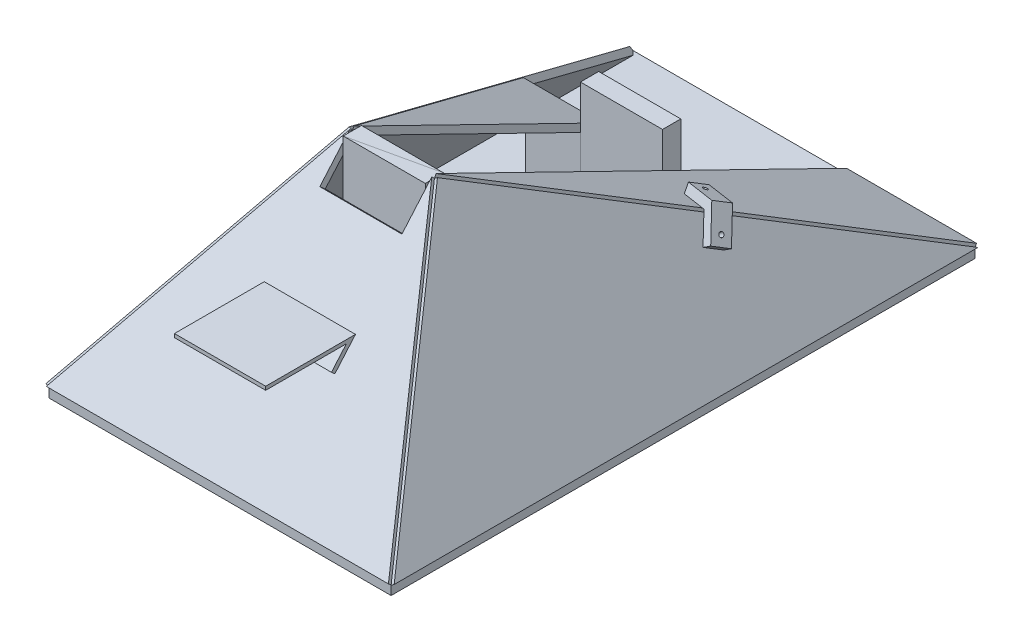
from build123d import *

# Parameters (mm, degrees)
BOSS_EXTRUDE1_DEPTH                  = 5
BOSS_EXTRUDE2_DEPTH                  = 5
SKETCH2_W                            = 114.3
SKETCH2_H                            = 25.4
BOSS_EXTRUDE3_DEPTH                  = 279.4
BOSS_EXTRUDE3_2_DEPTH                = 279.4
BOSS_EXTRUDE4_DEPTH                  = 25.4
SKETCH1_W                            = 476.25
SKETCH1_H                            = 812.8
BOSS_EXTRUDE5_DEPTH                  = 12.7
BOSS_EXTRUDE6_DEPTH                  = 25.4
MOVE_FACE1_BY                        = 6.35
MOVE_FACE1_2_BY                      = 6.35
BOSS_EXTRUDE7_DEPTH                  = 5
BOSS_EXTRUDE8_DEPTH                  = 5
BOSS_EXTRUDE9_DEPTH                  = 25.4
BOSS_EXTRUDE10_DEPTH                 = 63.5
CUT_EXTRUDE1_DEPTH                   = 3
SKETCH26_W                           = 3.175
SKETCH26_H                           = 631.796713068
F_1_4_0_25_DIAMETER_HOLE1_AT_2_COUNT = 2
F_1_4_0_25_DIAMETER_HOLE1_AT_2_PITCH = 63.5
BOSS_EXTRUDE11_DEPTH                 = 25.4
BOSS_EXTRUDE12_DEPTH                 = 25.4
MOVE_FACE2_BY                        = 6.35
MOVE_FACE3_BY                        = 50.8
BOSS_EXTRUDE13_START                 = -310
BOSS_EXTRUDE13_DEPTH                 = 25.4
SKETCH40_W                           = 3.175
SKETCH40_H                           = 386.099476677
SKETCH42_W                           = 3.175
SKETCH42_H                           = 424.327688964
SKETCH43_W                           = 114.3
SKETCH43_H                           = 25.4
BOSS_EXTRUDE15_DEPTH                 = 279.4
SKETCH44_W                           = 114.3
SKETCH44_H                           = 25.4
CUT_EXTRUDE2_DEPTH                   = 100
BOSS_EXTRUDE16_DEPTH                 = 10


with BuildPart() as part:
    # Sketch4 → Boss-Extrude1 (new, symmetric)
    with BuildSketch(Plane(origin=(167.746747931, 108.654143546, 0), x_dir=(0, 0, -1), z_dir=(0.8393141755459909, 0.5436466818877439, 0))):
        Polygon((-406.4, -129.455866125), (-165.1, 203.434972778), (406.4, -129.455866125), align=None)
    extrude(amount=BOSS_EXTRUDE1_DEPTH, both=True)


with BuildPart() as body_2:
    # Sketch5 → Boss-Extrude2 (new, symmetric)
    with BuildSketch(Plane(origin=(-167.746747931, 108.654143546, 0), x_dir=(0, 0, 1), z_dir=(-0.8393141755459907, 0.543646681887744, 0))):
        Polygon((165.1, 203.434972778), (-406.4, -129.455866125), (406.4, -129.455866125), align=None)
    extrude(amount=BOSS_EXTRUDE2_DEPTH, both=True)


with BuildPart() as body_3:
    # Sketch2 → Boss-Extrude3 (new body)
    with BuildSketch(Plane(origin=(0, 279.4, 0), x_dir=(1, 0, 0), z_dir=(0, 1, 0))):
        with Locations((0, -165.1)):
            Rectangle(SKETCH2_W, SKETCH2_H)
    extrude(amount=-BOSS_EXTRUDE3_DEPTH)

    # Sketch1 → Boss-Extrude5 (add)
    with BuildSketch(Plane(origin=(0, 0, 0), x_dir=(1, 0, 0), z_dir=(0, 1, 0))):
        Rectangle(SKETCH1_W, SKETCH1_H)
    extrude(amount=-BOSS_EXTRUDE5_DEPTH)


with BuildPart() as body_4:
    # Sketch2 → Boss-Extrude3 2 (new body)
    with BuildSketch(Plane(origin=(0, 279.4, 0), x_dir=(1, 0, 0), z_dir=(0, 1, 0))):
        with Locations((0, 165.1)):
            Rectangle(SKETCH2_W, SKETCH2_H)
    extrude(amount=-BOSS_EXTRUDE3_2_DEPTH)

    # Sketch44 → Cut-Extrude2 (cut)
    with BuildSketch(Plane(origin=(0, 279.4, 0), x_dir=(1, 0, 0), z_dir=(0, 1, 0))):
        with Locations((0, 165.1)):
            Rectangle(SKETCH44_W, SKETCH44_H)
    extrude(amount=-CUT_EXTRUDE2_DEPTH, mode=Mode.SUBTRACT)


with BuildPart() as body_5:
    # Sketch6 → Boss-Extrude4 (new body)
    with BuildSketch(Plane.XY.offset(177.8)):
        Polygon((57.15, 152.560744885), (57.15, 177.960744885), (116.897727273, 177.960744885), (133.35, 152.560744885), align=None)
    extrude(amount=-BOSS_EXTRUDE4_DEPTH)

    # Sketch9 → CBORE for 1_4 Binding Head Machine Screw (revolve, cut)
    with BuildSketch(Plane(origin=(133.35, 165.260744885, 165.1), x_dir=(0, 0, -1), z_dir=(0, 1, 0))):
        Polygon((0, 0), (0, 375.671570878), (3.3782, 375.671570878), (3.3782, 54.1910016), (7.14375, 54.1910016), (7.14375, 0), align=None)
    revolve(axis=Axis((139.7, 165.260744885, 165.1), (-1, 0, 0)), mode=Mode.SUBTRACT)


with BuildPart() as body_6:
    # Sketch10 → Boss-Extrude6 (new body)
    with BuildSketch(Plane.XY.offset(177.8)):
        Polygon((182.810937028, 0), (208.210937028, 0), (208.210937028, 36.985964912), (182.810937028, 76.2), align=None)
    extrude(amount=BOSS_EXTRUDE6_DEPTH)

    # Sketch12 → CBORE for 1_4 Binding Head Machine S 2 (revolve, cut)
    with BuildSketch(Plane(origin=(195.510937028, 76.2, 190.5), x_dir=(0, 0, 1), z_dir=(1, 0, 0))):
        Polygon((0, 0), (0, 88.9), (3.3782, 88.9), (3.3782, 64.191007), (7.14375, 64.191007), (7.14375, 0), align=None)
    revolve(axis=Axis((195.510937028, 82.55, 190.5), (0, -1, 0)), mode=Mode.SUBTRACT)


with BuildPart() as body_7:
    # Mirror2: mirrored copy
    add(body_6.part.mirror(Plane(origin=(0, 0, 0), x_dir=(0, 0, 1), z_dir=(1, 0, 0))))

    # Move Face1: a face moved outward by 6.35
    extrude(body_7.faces().sort_by_distance((-199.082812028, 12.008993, 190.5))[0], amount=MOVE_FACE1_BY, dir=(0, 1, 0))

    # Move Face1 2: a face moved inward by 6.35
    extrude(body_7.faces().sort_by_distance((-195.510937028, 0, 196.85))[0], amount=MOVE_FACE1_2_BY, dir=(0, 1, 0), mode=Mode.SUBTRACT)


with BuildPart() as body_8:
    # Sketch14 → Boss-Extrude7 (new, symmetric)
    with BuildSketch(Plane(origin=(0, 201.035739645, 232.778224852), x_dir=(1, 0, 0), z_dir=(0, 0.6536198703460926, 0.7568230077691593))):
        Polygon((-57.15, 103.543707777), (-238.125, -265.631115309), (238.125, -265.631115309), (57.15, 103.543707777), (57.15, 40.043707777), (-57.15, 40.043707777), align=None)
    extrude(amount=BOSS_EXTRUDE7_DEPTH, both=True)


with BuildPart() as body_9:
    # Sketch15 → Boss-Extrude8 (new, symmetric)
    with BuildSketch(Plane(origin=(0, 160.357114388, -78.396811479), x_dir=(-1, 0, 0), z_dir=(0, -0.8983843609192009, 0.4392101320049427))):
        Polygon((-57.15, -271.03856887), (-57.15, 365.103404278), (-238.125, 365.103404278), align=None)
    extrude(amount=BOSS_EXTRUDE8_DEPTH, both=True)


with BuildPart() as body_10:
    # Sketch16 → Boss-Extrude9 (new body)
    with BuildSketch(Plane(origin=(57.15, 0, 0), x_dir=(0, 0, -1), z_dir=(1, 0, 0))):
        Polygon((-177.8, 194.213451656), (-177.8, 168.813451656), (-254, 168.813451656), (-232.063636364, 194.213451656), align=None)
    extrude(amount=-BOSS_EXTRUDE9_DEPTH)


with BuildPart() as cbore_for_1_4_binding_head_machine_s_3_tool:
    # Sketch20 → CBORE for 1_4 Binding Head Machine S 3 (revolve)
    with BuildSketch(Plane(origin=(44.45, 181.513451656, 254), x_dir=(0, -1, 0), z_dir=(1, 0, 0))):
        Polygon((0, 0), (0, 662.59605066), (3.3782, 662.59605066), (3.3782, 64.191007), (7.14375, 64.191007), (7.14375, 0), align=None)
    revolve(axis=Axis((44.45, 181.513451656, 260.35), (0, 0, -1)))


with BuildPart() as body_3_1:
    add(body_3.part)

    # CBORE for 1_4 Binding Head Machine S 3: cut by cbore_for_1_4_binding_head_machine_s_3_tool
    add(cbore_for_1_4_binding_head_machine_s_3_tool.part, mode=Mode.SUBTRACT)


with BuildPart() as body_10_1:
    add(body_10.part)

    # CBORE for 1_4 Binding Head Machine S 3: cut by cbore_for_1_4_binding_head_machine_s_3_tool
    add(cbore_for_1_4_binding_head_machine_s_3_tool.part, mode=Mode.SUBTRACT)


with BuildPart() as body_11:
    # Sketch21 → Boss-Extrude10 (new, symmetric)
    with BuildSketch(Plane(origin=(0, 0, 0), x_dir=(0, 0, -1), z_dir=(1, 0, 0))):
        Polygon((-406.4, 147.4), (-294.096901367, 147.4), (-314.849332251, 123.370869503), (-310.043506151, 119.220383327), (-281.388382661, 152.4), (-406.4, 152.4), align=None)
    extrude(amount=BOSS_EXTRUDE10_DEPTH, both=True)

    # Sketch22 → Cut-Extrude1 (cut)
    with BuildSketch(Plane(origin=(0, 208.454325173, 241.36816599), x_dir=(1, 0, 0), z_dir=(0, 0.653619870346092, 0.75682300776916))):
        Polygon((-35.127499075, -93.871867196), (-38.50499815, -99.721867196), (-35.127499075, -105.571867196), (-28.372500925, -105.571867196), (-24.99500185, -99.721867196), (-28.372500925, -93.871867196), align=None)
        Polygon((35.127499075, -93.871867196), (28.372500925, -93.871867196), (24.99500185, -99.721867196), (28.372500925, -105.571867196), (35.127499075, -105.571867196), (38.50499815, -99.721867196), align=None)
    extrude(amount=-CUT_EXTRUDE1_DEPTH, mode=Mode.SUBTRACT)

    # Sketch26 → 1/4 (0.25) Diameter Hole1 (revolve, cut)
    with BuildSketch(Plane(origin=(31.75, 131.021662091, 304.277890874), x_dir=(0, -0.7568230077691582, 0.6536198703460939), z_dir=(1, 0, 0))):
        with Locations((1.5875, 315.898356534)):
            Rectangle(SKETCH26_W, SKETCH26_H)
    f_1_4_0_25_diameter_hole1 = revolve(axis=Axis((31.75, 135.172148268, 309.083716973), (0, -0.653619870346094, -0.7568230077691582)), mode=Mode.SUBTRACT)

    # 1/4 (0.25) Diameter Hole1 at 2: 1/4 (0.25) Diameter Hole1 ×2
    with Locations(*[(-i * F_1_4_0_25_DIAMETER_HOLE1_AT_2_PITCH, 0, 0) for i in range(1, F_1_4_0_25_DIAMETER_HOLE1_AT_2_COUNT)]):
        add(f_1_4_0_25_diameter_hole1, mode=Mode.SUBTRACT)


with BuildPart() as body_12:
    # Sketch27 → Boss-Extrude11 (new body)
    with BuildSketch(Plane(origin=(57.15, 0, 0), x_dir=(0, 0, -1), z_dir=(1, 0, 0))):
        Polygon((-152.4, 217.954453428), (-50.8, 217.954453428), (-102.754545455, 243.354453428), (-152.4, 243.354453428), align=None)
    extrude(amount=BOSS_EXTRUDE11_DEPTH)

    # Sketch30 → CBORE for 1_4 Binding Head Machine S 4 (revolve, cut)
    with BuildSketch(Plane(origin=(69.85, 230.654453428, 50.8), x_dir=(0, 1, 0), z_dir=(1, 0, 0))):
        Polygon((0, 0), (0, 359.384115039), (3.3782, 359.384115039), (3.3782, 74.1910124), (7.14375, 74.1910124), (7.14375, 0), align=None)
    revolve(axis=Axis((69.85, 230.654453428, 44.45), (0, 0, 1)), mode=Mode.SUBTRACT)


with BuildPart() as body_13:
    # Sketch31 → Boss-Extrude12 (new body)
    with BuildSketch(Plane(origin=(57.15, 0, 0), x_dir=(0, 0, -1), z_dir=(1, 0, 0))):
        Polygon((177.8, 0), (177.8, 106.194453428), (152.4, 118.612231206), (152.4, 0), align=None)
    extrude(amount=BOSS_EXTRUDE12_DEPTH)

    # Sketch33 → CBORE for 1_4 Binding Head Machine S 5 (revolve, cut)
    with BuildSketch(Plane(origin=(69.85, 118.612231206, -165.1), x_dir=(0, 0, 1), z_dir=(1, 0, 0))):
        Polygon((0, 0), (0, 131.312231206), (3.3782, 131.312231206), (3.3782, 94.1909978), (7.14375, 94.1909978), (7.14375, 0), align=None)
    revolve(axis=Axis((69.85, 124.962231206, -165.1), (0, -1, 0)), mode=Mode.SUBTRACT)


with BuildPart() as body_14:
    # Mirror3: mirrored copy
    add(body_13.part.mirror(Plane(origin=(0, 0, 0), x_dir=(0, 0, 1), z_dir=(1, 0, 0))))

    # Move Face2: a face moved inward by 6.35
    extrude(body_14.faces().sort_by_distance((-76.2, 0, -165.1))[0], amount=MOVE_FACE2_BY, dir=(0, 1, 0), mode=Mode.SUBTRACT)

    # Move Face3: a face moved outward by 50.8
    extrude(body_14.faces().sort_by_distance((-82.55, 59.437254353, -164.852159661))[0], amount=MOVE_FACE3_BY, dir=(-1, 0, 0))


with BuildPart() as body_15:
    # Sketch36 → Boss-Extrude13 (new body)
    with BuildSketch(Plane(origin=(113.920036066, -175.876546908, -359.747482313), x_dir=(0, 0.8983843609192015, -0.4392101320049416), z_dir=(0.2736308235120385, -0.42244758717647923, -0.8640973374064376)).offset(BOSS_EXTRUDE13_START)):
        Polygon((183.494997647, 93.964753586), (183.494997647, 132.064753586), (150.248258953, 150.672933675), (156.450985649, 161.755179906), (196.194997647, 139.510479772), (196.194997647, 93.964753586), align=None)
    extrude(amount=-BOSS_EXTRUDE13_DEPTH)

    # Sketch40 → 1/4 (0.25) Diameter Hole2 (revolve, cut)
    with BuildSketch(Plane(origin=(128.213240693, 149.524929679, -140.853169697), x_dir=(0, 0.43921013200494147, 0.8983843609192014), z_dir=(1, 0, 0))):
        with Locations((1.5875, 193.049738339)):
            Rectangle(SKETCH40_W, SKETCH40_H)
    revolve(axis=Axis((128.213240693, 155.229670371, -143.642154035), (0, -0.8983843609192014, 0.4392101320049416)), mode=Mode.SUBTRACT)

    # Sketch42 → 1/4 (0.25) Diameter Hole3 (revolve, cut)
    with BuildSketch(Plane(origin=(175.235131227, 129.651041214, -116.246781111), x_dir=(-0.5436466818877439, 0.8393141755459907, 0), z_dir=(0, 0, 1))):
        with Locations((1.5875, 212.163844482)):
            Rectangle(SKETCH42_W, SKETCH42_H)
    revolve(axis=Axis((180.564776242, 133.103197644, -116.246781111), (-0.8393141755459909, -0.5436466818877438, 0)), mode=Mode.SUBTRACT)


with BuildPart() as body_16:
    # Sketch43 → Boss-Extrude15 (new body)
    with BuildSketch(Plane.XZ):
        with Locations((0, 165.1)):
            Rectangle(SKETCH43_W, SKETCH43_H)
    extrude(amount=-BOSS_EXTRUDE15_DEPTH)


with BuildPart() as body_17:
    # Sketch45 → Boss-Extrude16 (new body)
    with BuildSketch(Plane(origin=(0, 155.865192584, -76.200760819), x_dir=(1, 0, 0), z_dir=(2.159739572246495e-15, 0.8983843609192007, -0.43921013200494297))):
        Polygon((-57.15, 113.091059463), (-166.430416042, 113.091059463), (-57.15, -271.03856887), align=None)
    extrude(amount=BOSS_EXTRUDE16_DEPTH)


solid = Compound([part.part, body_2.part, body_4.part, body_5.part, body_6.part, body_7.part, body_8.part, body_9.part, body_3_1.part, body_10_1.part, body_11.part, body_12.part, body_13.part, body_14.part, body_15.part, body_16.part, body_17.part])
